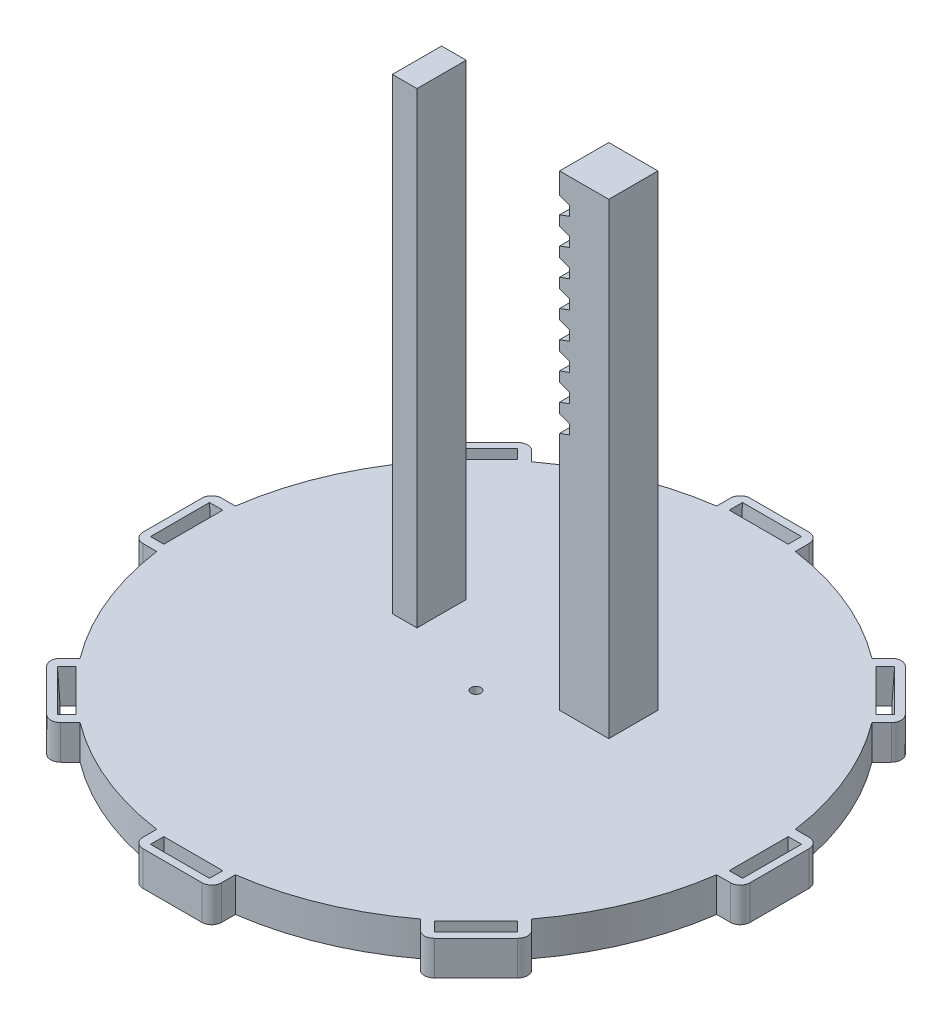
from build123d import *

# Parameters (mm, degrees)
BOSS_EXTRUDE1_DEPTH = 7
SKETCH2_W           = 10
SKETCH2_H           = 10
SKETCH2_W_2         = 5
BOSS_EXTRUDE2_DEPTH = 95
SKETCH15_R          = 1
CUT_EXTRUDE3_DEPTH  = 7
CIRPATTERN1_COUNT   = 8
CUT_EXTRUDE4_DEPTH  = 10
LPATTERN1_COUNT     = 8
LPATTERN1_PITCH     = 5.5


with BuildPart() as part:
    # Sketch1 → Boss-Extrude1 (new body)
    with BuildSketch(Plane(origin=(0, 0, 0), x_dir=(1, 0, 0), z_dir=(0, 1, 0))):
        with BuildLine():
            Line((-8, 56.940758688), (-8, 59.740758688))
            ThreePointArc((-8, 59.740758688), (-7.414213562, 61.154972251), (-6, 61.740758688))
            Line((-6, 61.740758688), (6, 61.740758688))
            ThreePointArc((6, 61.740758688), (7.414213562, 61.154972251), (8, 59.740758688))
            Line((8, 59.740758688), (8, 56.940758688))
            ThreePointArc((8, 56.940758688), (22.004297361, 53.123073119), (34.606342345, 45.920050844))
            Line((34.606342345, 45.920050844), (36.586241332, 47.899949831))
            ThreePointArc((36.586241332, 47.899949831), (38.000454895, 48.485736269), (39.414668457, 47.899949831))
            Line((39.414668457, 47.899949831), (47.899949831, 39.414668457))
            ThreePointArc((47.899949831, 39.414668457), (48.485736269, 38.000454895), (47.899949831, 36.586241332))
            Line((47.899949831, 36.586241332), (45.920050844, 34.606342345))
            ThreePointArc((45.920050844, 34.606342345), (53.123073119, 22.004297361), (56.940758688, 8))
            Line((56.940758688, 8), (59.740758688, 8))
            ThreePointArc((59.740758688, 8), (61.154972251, 7.414213562), (61.740758688, 6))
            Line((61.740758688, 6), (61.740758688, -6))
            ThreePointArc((61.740758688, -6), (61.154972251, -7.414213562), (59.740758688, -8))
            Line((59.740758688, -8), (56.940758688, -8))
            ThreePointArc((56.940758688, -8), (53.123073119, -22.004297361), (45.920050844, -34.606342345))
            Line((45.920050844, -34.606342345), (47.899949831, -36.586241332))
            ThreePointArc((47.899949831, -36.586241332), (48.485736269, -38.000454895), (47.899949831, -39.414668457))
            Line((47.899949831, -39.414668457), (39.414668457, -47.899949831))
            ThreePointArc((39.414668457, -47.899949831), (38.000454895, -48.485736269), (36.586241332, -47.899949831))
            Line((36.586241332, -47.899949831), (34.606342345, -45.920050844))
            ThreePointArc((34.606342345, -45.920050844), (22.004297361, -53.123073119), (8, -56.940758688))
            Line((8, -56.940758688), (8, -59.740758688))
            ThreePointArc((8, -59.740758688), (7.414213562, -61.154972251), (6, -61.740758688))
            Line((6, -61.740758688), (-6, -61.740758688))
            ThreePointArc((-6, -61.740758688), (-7.414213562, -61.154972251), (-8, -59.740758688))
            Line((-8, -59.740758688), (-8, -56.940758688))
            ThreePointArc((-8, -56.940758688), (-22.004297361, -53.123073119), (-34.606342345, -45.920050844))
            Line((-34.606342345, -45.920050844), (-36.586241332, -47.899949831))
            ThreePointArc((-36.586241332, -47.899949831), (-38.000454895, -48.485736269), (-39.414668457, -47.899949831))
            Line((-39.414668457, -47.899949831), (-47.899949831, -39.414668457))
            ThreePointArc((-47.899949831, -39.414668457), (-48.485736269, -38.000454895), (-47.899949831, -36.586241332))
            Line((-47.899949831, -36.586241332), (-45.920050844, -34.606342345))
            ThreePointArc((-45.920050844, -34.606342345), (-53.123073119, -22.004297361), (-56.940758688, -8))
            Line((-56.940758688, -8), (-59.740758688, -8))
            ThreePointArc((-59.740758688, -8), (-61.154972251, -7.414213562), (-61.740758688, -6))
            Line((-61.740758688, -6), (-61.740758688, 6))
            ThreePointArc((-61.740758688, 6), (-61.154972251, 7.414213562), (-59.740758688, 8))
            Line((-59.740758688, 8), (-56.940758688, 8))
            ThreePointArc((-56.940758688, 8), (-53.123073119, 22.004297361), (-45.920050844, 34.606342345))
            Line((-45.920050844, 34.606342345), (-47.899949831, 36.586241332))
            ThreePointArc((-47.899949831, 36.586241332), (-48.485736269, 38.000454895), (-47.899949831, 39.414668457))
            Line((-47.899949831, 39.414668457), (-39.414668457, 47.899949831))
            ThreePointArc((-39.414668457, 47.899949831), (-38.000454895, 48.485736269), (-36.586241332, 47.899949831))
            Line((-36.586241332, 47.899949831), (-34.606342345, 45.920050844))
            ThreePointArc((-34.606342345, 45.920050844), (-22.004297361, 53.123073119), (-8, 56.940758688))
        make_face()
    extrude(amount=BOSS_EXTRUDE1_DEPTH)

    # Sketch2 → Boss-Extrude2 (add)
    with BuildSketch(Plane(origin=(0, 7, 0), x_dir=(1, 0, 0), z_dir=(0, 1, 0))):
        with Locations((17, 10)):
            Rectangle(SKETCH2_W, SKETCH2_H)
        with Locations((-19.5, 10)):
            Rectangle(SKETCH2_W_2, SKETCH2_H)
    extrude(amount=BOSS_EXTRUDE2_DEPTH)

    # Sketch15 → Cut-Extrude3 (cut)
    with BuildSketch(Plane.XZ):
        with Locations(Location((0, 0, 0), (0, 0, 270))):
            Circle(SKETCH15_R)
    extrude(amount=-CUT_EXTRUDE3_DEPTH, mode=Mode.SUBTRACT)

    # Sketch16 → Cut-Loft2 section 0
    with BuildSketch(Plane.XZ):
        with BuildLine():
            Line((-6, 59.8), (6, 59.8))
            Line((6, 59.8), (6, 57.5))
            Line((6, 57.5), (-6, 57.5))
            Line((-6, 57.5), (-6, 59.8))
        make_face()
    # Sketch17 → Cut-Loft2 section 1
    with BuildSketch(Plane(origin=(0, 7, 0), x_dir=(1, 0, 0), z_dir=(0, 1, 0))):
        with BuildLine():
            Line((-6, -57.5), (6, -57.5))
            Line((6, -57.5), (6, -60.2))
            Line((6, -60.2), (-6, -60.2))
            Line((-6, -60.2), (-6, -57.5))
        make_face()
    cut_loft2 = loft(mode=Mode.SUBTRACT)

    # CirPattern1: Cut-Loft2 ×8 about axis
    cirpattern1_axis = Axis((0, 0, 0), (0, 1, 0))
    for i in range(1, CIRPATTERN1_COUNT):
        add(cut_loft2.rotate(cirpattern1_axis, i * 360 / CIRPATTERN1_COUNT), mode=Mode.SUBTRACT)

    # Sketch18 → Cut-Extrude4 (cut)
    with BuildSketch(Plane(origin=(0, 0, -15), x_dir=(-1, 0, 0), z_dir=(0, 0, -1))):
        Polygon((-12, 97.727940469), (-14, 97), (-14, 95), (-12, 94.272059531), align=None)
    cut_extrude4 = extrude(amount=-CUT_EXTRUDE4_DEPTH, mode=Mode.SUBTRACT)

    # LPattern1: Cut-Extrude4 ×8
    with Locations(*[(0, -i * LPATTERN1_PITCH, 0) for i in range(1, LPATTERN1_COUNT)]):
        add(cut_extrude4, mode=Mode.SUBTRACT)


solid = part.part
